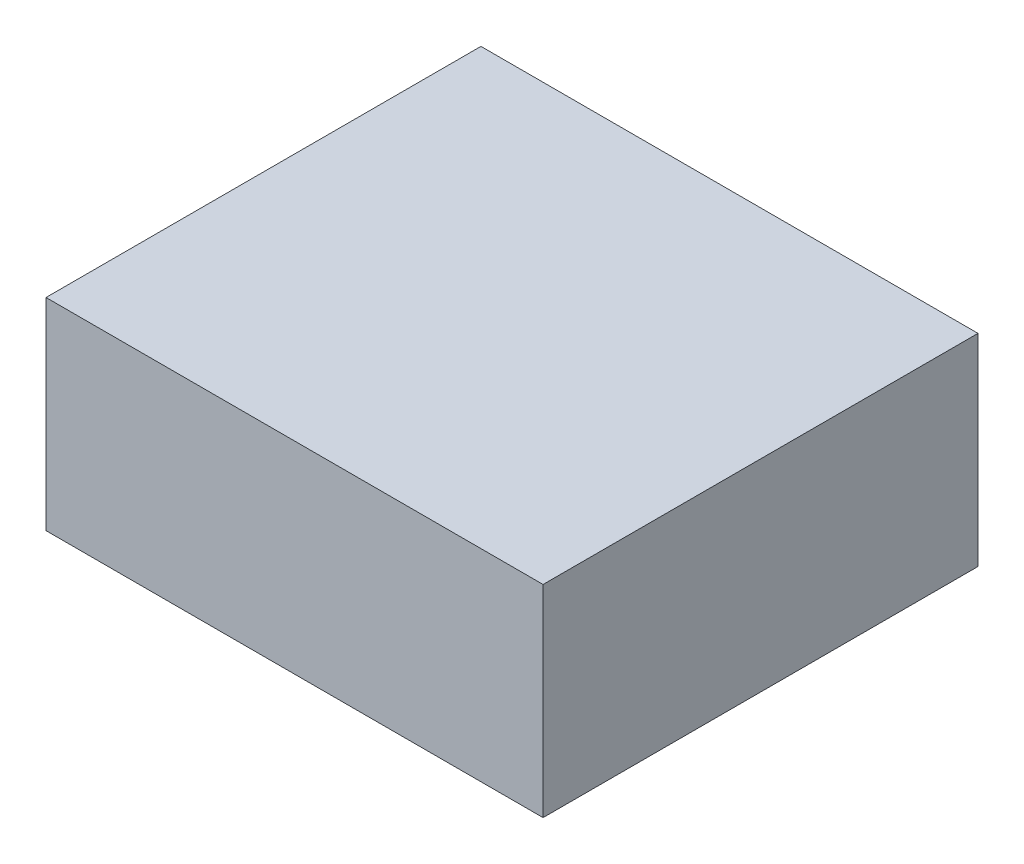
from build123d import *

# Parameters (mm, degrees)
SKETCH1_W           = 160.00000004
SKETCH1_H           = 65.000000048
BOSS_EXTRUDE1_DEPTH = 69.999999954


with BuildPart() as part:
    # Sketch1 → Boss-Extrude1 (new, symmetric)
    with BuildSketch(Plane.XY):
        Rectangle(SKETCH1_W, SKETCH1_H)
    extrude(amount=BOSS_EXTRUDE1_DEPTH, both=True)


solid = part.part
